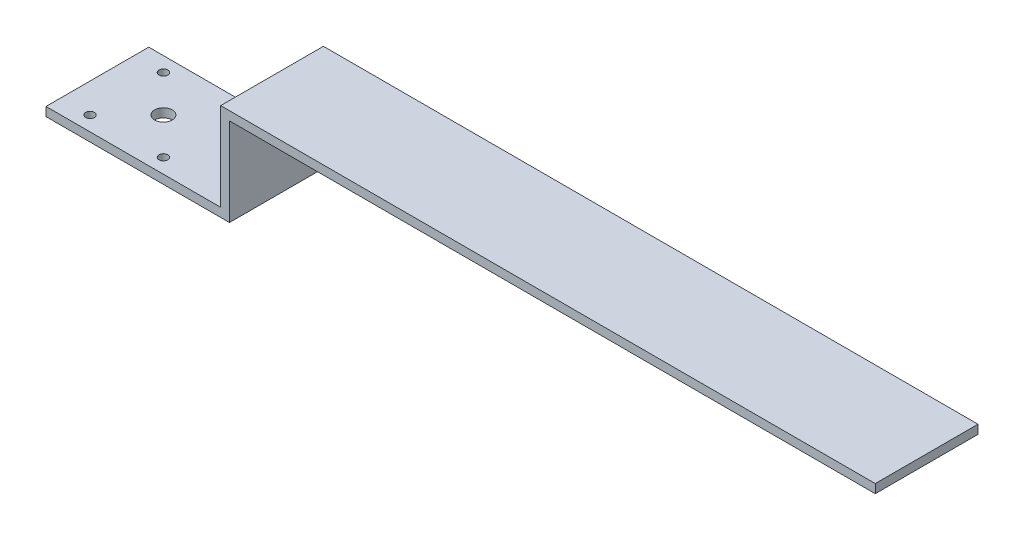
from build123d import *

# Parameters (mm, degrees)
SKETCH1_W           = 62.5
SKETCH1_H           = 35
SKETCH1_R           = 1.5
SKETCH1_R_2         = 3
BOSS_EXTRUDE1_DEPTH = 3
SKETCH3_W           = 3
SKETCH3_H           = 35
BOSS_EXTRUDE3_DEPTH = 30
SKETCH4_W           = 35
SKETCH4_H           = 3
BOSS_EXTRUDE4_DEPTH = 220


with BuildPart() as part:
    # Sketch1 → Boss-Extrude1 (new body)
    with BuildSketch(Plane(origin=(0, 0, 0), x_dir=(1, 0, 0), z_dir=(0, 1, 0))):
        Rectangle(SKETCH1_W, SKETCH1_H)
        with Locations(Location((-21.25, 12.5, 0), (0, 0, 270))):
            Circle(SKETCH1_R, mode=Mode.SUBTRACT)
        with Locations(Location((-21.25, -12.5, 0), (0, 0, 270))):
            Circle(SKETCH1_R, mode=Mode.SUBTRACT)
        with Locations(Location((3.75, 12.5, 0), (0, 0, 270))):
            Circle(SKETCH1_R, mode=Mode.SUBTRACT)
        with Locations(Location((3.75, -12.5, 0), (0, 0, 270))):
            Circle(SKETCH1_R, mode=Mode.SUBTRACT)
        with Locations(Location((-8.75, 0, 0), (0, 0, 270))):
            Circle(SKETCH1_R_2, mode=Mode.SUBTRACT)
    extrude(amount=BOSS_EXTRUDE1_DEPTH)

    # Sketch3 → Boss-Extrude3 (add)
    with BuildSketch(Plane(origin=(0, 3, 0), x_dir=(1, 0, 0), z_dir=(0, 1, 0))):
        with Locations((29.75, 0)):
            Rectangle(SKETCH3_W, SKETCH3_H)
    extrude(amount=BOSS_EXTRUDE3_DEPTH)

    # Sketch4 → Boss-Extrude4 (add)
    with BuildSketch(Plane(origin=(31.25, 0, 0), x_dir=(0, 0, -1), z_dir=(1, 0, 0))):
        with Locations((0, 31.5)):
            Rectangle(SKETCH4_W, SKETCH4_H)
    extrude(amount=BOSS_EXTRUDE4_DEPTH)


solid = part.part
